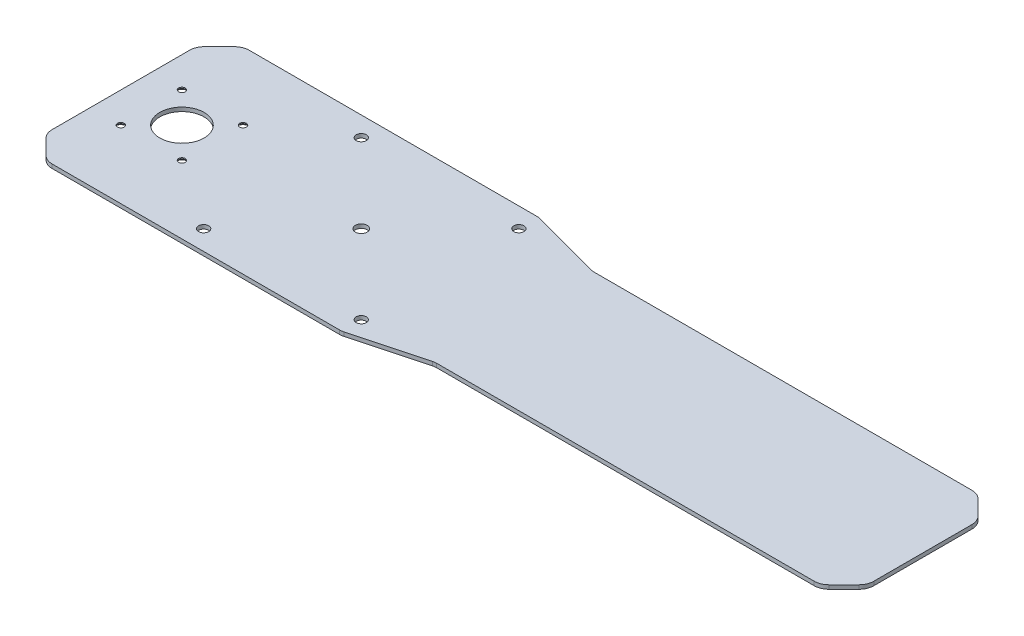
from build123d import *

# Parameters (mm, degrees)
BOSS_EXTRUDE2_DEPTH                          = 2
CHAMFER2_SIZE                                = 12
FILLET1_R                                    = 7.5
SKETCH2_R                                    = 2.575
SKETCH2_R_2                                  = 11.25
SKETCH2_R_3                                  = 3
CUT_EXTRUDE1_DEPTH                           = 290.359637821
CSK_FOR_M3_COUNTERSUNK_FLAT_HEAD_SCR_2_COUNT = 2
CSK_FOR_M3_COUNTERSUNK_FLAT_HEAD_SCR_2_PITCH = 31
CSK_FOR_M3_COUNTERSUNK_FLAT_HEAD_SCR_3_COUNT = 2
CSK_FOR_M3_COUNTERSUNK_FLAT_HEAD_SCR_3_PITCH = 43.840620434
CSK_FOR_M3_COUNTERSUNK_FLAT_HEAD_SCR_4_COUNT = 2
CSK_FOR_M3_COUNTERSUNK_FLAT_HEAD_SCR_4_PITCH = 31


with BuildPart() as part:
    # Sketch1 → Boss-Extrude2 (new body)
    with BuildSketch(Plane(origin=(0, 0, 0), x_dir=(1, 0, 0), z_dir=(0, 1, 0))):
        Polygon((40, -50), (77.320508076, -40), (285, -40), (285, 40), (77.320508076, 40), (40, 50), (-40, 50), (-122, 50), (-122, -50), (-40, -50), align=None)
    extrude(amount=BOSS_EXTRUDE2_DEPTH)

    # Chamfer2
    chamfer2_edges = [part.edges().sort_by_distance(p)[0] for p in [
        (-122, 1, 50),
        (-122, 1, -50),
        (285, 1, -40),
        (285, 1, 40),
    ]]
    chamfer(chamfer2_edges, length=CHAMFER2_SIZE)

    # Fillet1
    fillet1_edges = [part.edges().sort_by_distance(p)[0] for p in [
        (40, 1, -50),
        (77.320508076, 1, -40),
        (77.320508076, 1, 40),
        (40, 1, 50),
        (-110, 1, 50),
        (-122, 1, -38),
        (-122, 1, 38),
        (-110, 1, -50),
        (273, 1, -40),
        (285, 1, 28),
        (285, 1, -28),
        (273, 1, 40),
    ]]
    fillet(fillet1_edges, radius=FILLET1_R)

    # Sketch2 → Cut-Extrude1 (cut, through all)
    with BuildSketch(Plane(origin=(0, 2, 0), x_dir=(1, 0, 0), z_dir=(0, 1, 0))):
        with Locations(Location((-40, 40, 0), (0, 0, 270))):
            Circle(SKETCH2_R)
        with Locations(Location((40, 40, 0), (0, 0, 90))):
            Circle(SKETCH2_R)
        with Locations(Location((40, -40, 0), (0, 0, 270))):
            Circle(SKETCH2_R)
        with Locations(Location((-40, -40, 0), (0, 0, 90))):
            Circle(SKETCH2_R)
        with Locations(Location((-91, 0, 0), (0, 0, 270))):
            Circle(SKETCH2_R_2)
        with Locations(Location((0, 0, 0), (0, 0, 270))):
            Circle(SKETCH2_R_3)
    extrude(amount=-CUT_EXTRUDE1_DEPTH, mode=Mode.SUBTRACT)

    # Sketch4 → CSK for M3 Countersunk Flat Head Screw2 (revolve, cut)
    with BuildSketch(Plane(origin=(-106.5, 0, -15.5), x_dir=(0, 0, -1), z_dir=(1, 0, 0))):
        Polygon((0, 0), (0, 2), (1.7, 2), (1.7, 1.45), (3.15, 0), align=None)
    csk_for_m3_countersunk_flat_head_screw2 = revolve(axis=Axis((-106.5, -6.35, -15.5), (0, 1, 0)), mode=Mode.SUBTRACT)

    # CSK for M3 Countersunk Flat Head Scr 2: CSK for M3 Countersunk Flat Head Screw2 ×2
    with Locations(*[(0, 0, i * CSK_FOR_M3_COUNTERSUNK_FLAT_HEAD_SCR_2_PITCH) for i in range(1, CSK_FOR_M3_COUNTERSUNK_FLAT_HEAD_SCR_2_COUNT)]):
        add(csk_for_m3_countersunk_flat_head_screw2, mode=Mode.SUBTRACT)

    # CSK for M3 Countersunk Flat Head Scr 3: CSK for M3 Countersunk Flat Head Screw2 ×2
    with Locations(*[Vector(0.707106781186545, 0, 0.70710678118655) * (i * CSK_FOR_M3_COUNTERSUNK_FLAT_HEAD_SCR_3_PITCH) for i in range(1, CSK_FOR_M3_COUNTERSUNK_FLAT_HEAD_SCR_3_COUNT)]):
        add(csk_for_m3_countersunk_flat_head_screw2, mode=Mode.SUBTRACT)

    # CSK for M3 Countersunk Flat Head Scr 4: CSK for M3 Countersunk Flat Head Screw2 ×2
    with Locations(*[(i * CSK_FOR_M3_COUNTERSUNK_FLAT_HEAD_SCR_4_PITCH, 0, 0) for i in range(1, CSK_FOR_M3_COUNTERSUNK_FLAT_HEAD_SCR_4_COUNT)]):
        add(csk_for_m3_countersunk_flat_head_screw2, mode=Mode.SUBTRACT)


solid = part.part
